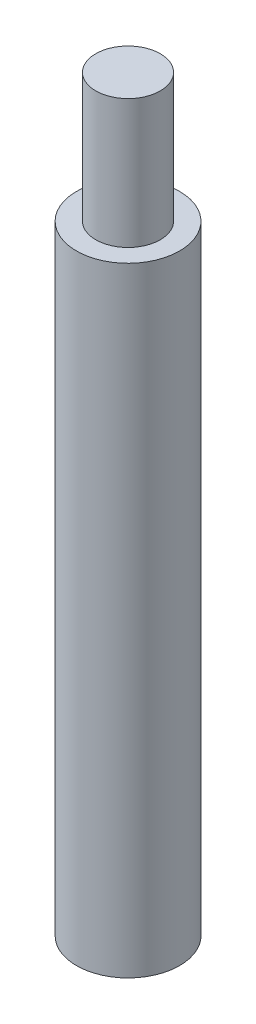
from build123d import *


with BuildPart() as part:
    # Croquis1 → Revolución1 (revolve)
    with BuildSketch(Plane.XY, mode=Mode.PRIVATE) as revoluci_n1_sk:
        Polygon((0, 0), (0, 116), (-5, 116), (-5, 96), (-8, 96), (-8, 0), align=None)
    revolve(revoluci_n1_sk.sketch.rotate(Axis((0, 0, 0), (0, 1, 0)), 270), axis=Axis((0, 0, 0), (0, 1, 0)))


solid = part.part
